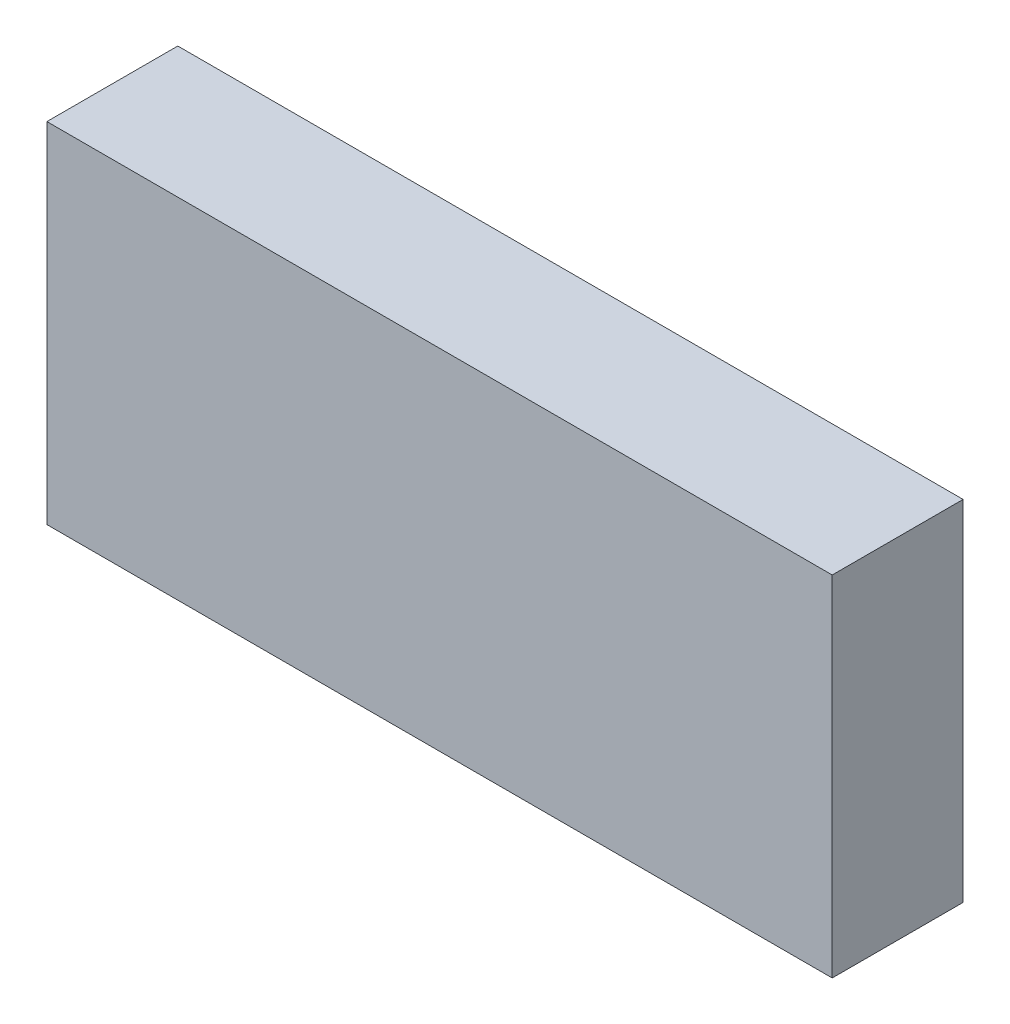
from build123d import *

# Parameters (mm, degrees)
SKETCH1_W           = 900
SKETCH1_H           = 400
BOSS_EXTRUDE1_DEPTH = 150


with BuildPart() as part:
    # Sketch1 → Boss-Extrude1 (new body)
    with BuildSketch(Plane.XY):
        with Locations((450, 200)):
            Rectangle(SKETCH1_W, SKETCH1_H)
    extrude(amount=BOSS_EXTRUDE1_DEPTH)


solid = part.part
